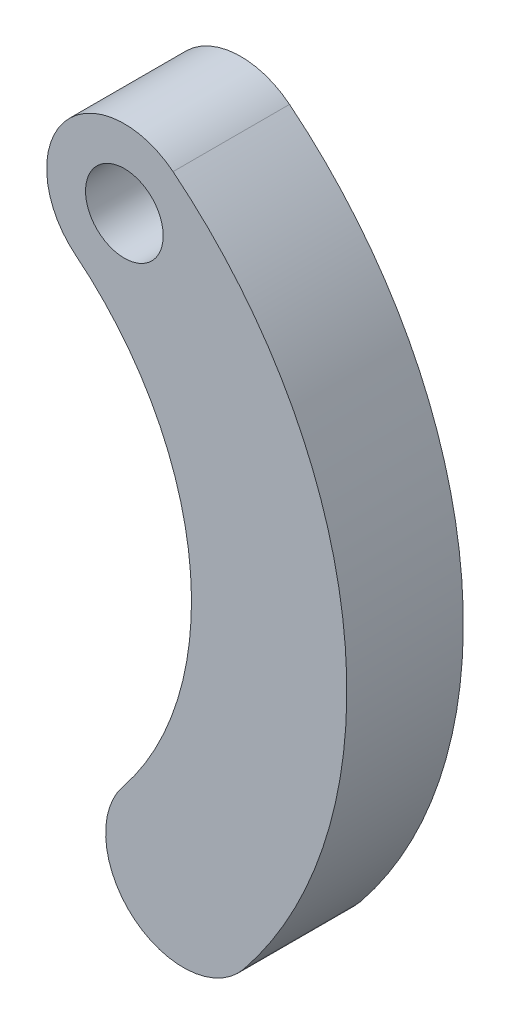
from build123d import *

# Parameters (mm, degrees)
SKETCH1_R           = 1
BOSS_EXTRUDE1_DEPTH = 3


with BuildPart() as part:
    # Sketch1 → Boss-Extrude1 (new body)
    with BuildSketch(Plane.XY):
        with BuildLine():
            ThreePointArc((3.076475365, -5.814545352), (5.659723746, 2.999084708), (1.254178611, 11.057894737))
            ThreePointArc((1.254178611, 11.057894737), (-1.557894737, 10.754178611), (-1.254178611, 7.942105263))
            ThreePointArc((-1.254178611, 7.942105263), (1.682851478, 2.569565244), (-0.039314109, -3.306188129))
            ThreePointArc((-0.039314109, -3.306188129), (0.264402017, -6.118261477), (3.076475365, -5.814545352))
        make_face()
        with Locations((0, 9.5)):
            Circle(SKETCH1_R, mode=Mode.SUBTRACT)
    extrude(amount=BOSS_EXTRUDE1_DEPTH)


solid = part.part
